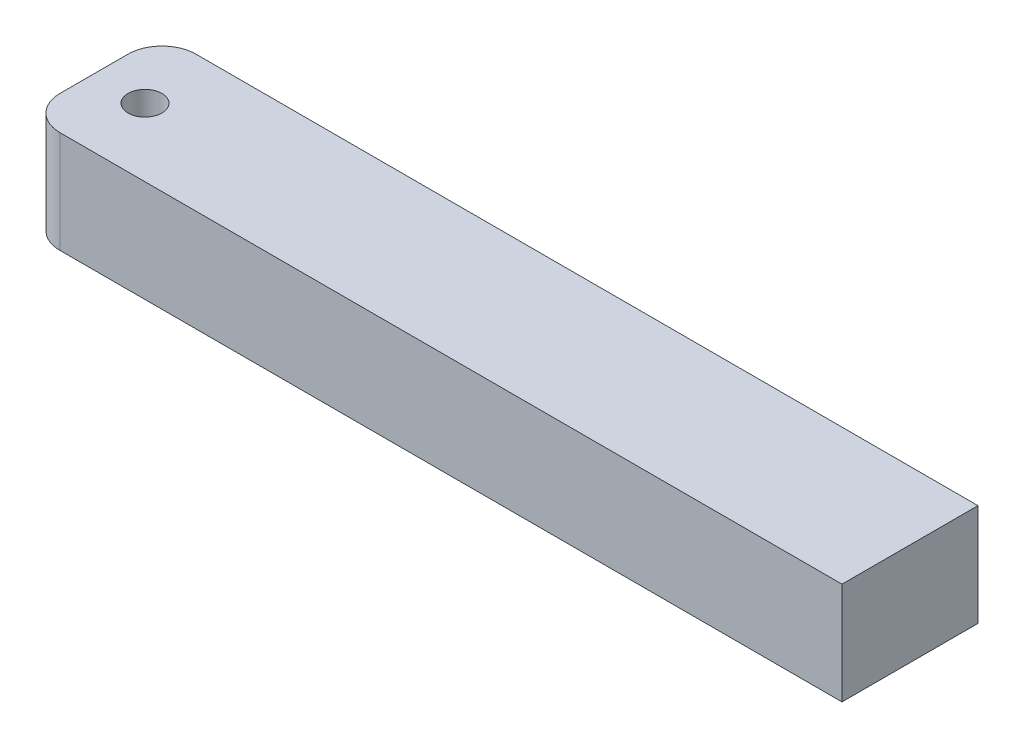
from build123d import *

# Parameters (mm, degrees)
SKETCH1_R           = 6.35
BOSS_EXTRUDE1_DEPTH = 38.1


with BuildPart() as part:
    # Sketch1 → Boss-Extrude1 (new body)
    with BuildSketch(Plane(origin=(0, 0, 0), x_dir=(1, 0, 0), z_dir=(0, 1, 0))):
        with BuildLine():
            Line((0, 0), (-292.1, 0))
            ThreePointArc((-292.1, 0), (-301.080256121, 3.719743879), (-304.8, 12.7))
            Line((-304.8, 12.7), (-304.8, 38.1))
            ThreePointArc((-304.8, 38.1), (-301.080256121, 47.080256121), (-292.1, 50.8))
            Line((-292.1, 50.8), (0, 50.8))
            Line((0, 50.8), (0, 0))
        make_face()
        with Locations(Location((-285.75, 25.4, 0), (0, 0, 90))):
            Circle(SKETCH1_R, mode=Mode.SUBTRACT)
    extrude(amount=BOSS_EXTRUDE1_DEPTH)


solid = part.part
